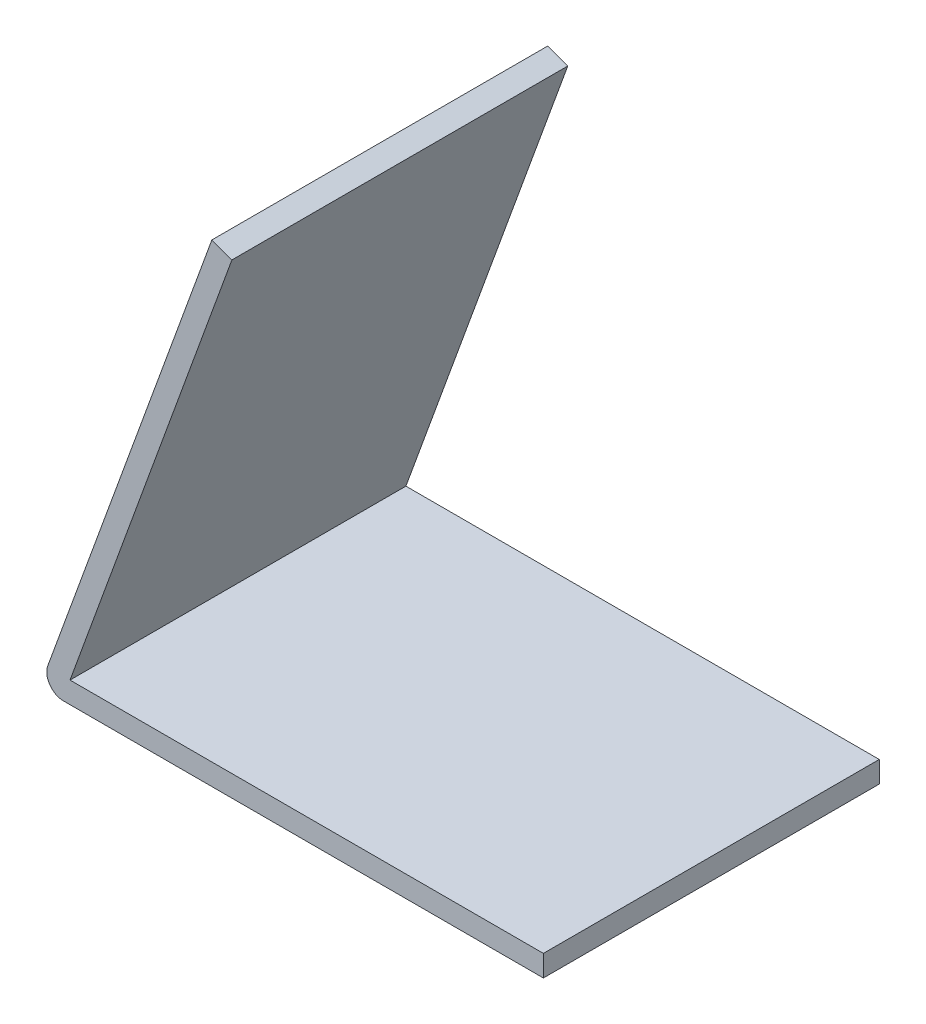
from build123d import *

# Parameters (mm, degrees)
BOSS_EXTRUDE1_DEPTH = 50
FILLET1_R           = 5


with BuildPart() as part:
    # Sketch1 → Boss-Extrude1 (new, symmetric)
    with BuildSketch(Plane.XY):
        Polygon((0, 0), (140.931260157, 0), (140.931260157, -6.35), (-9.068739843, -6.35), (42.234281656, 134.603893118), (48.201329798, 132.432065208), align=None)
    extrude(amount=BOSS_EXTRUDE1_DEPTH, both=True)

    # Fillet1
    fillet1_edges = [part.edges().sort_by_distance(p)[0] for p in [
        (-9.068739843, -6.35, 0),
    ]]
    fillet(fillet1_edges, radius=FILLET1_R)


solid = part.part
